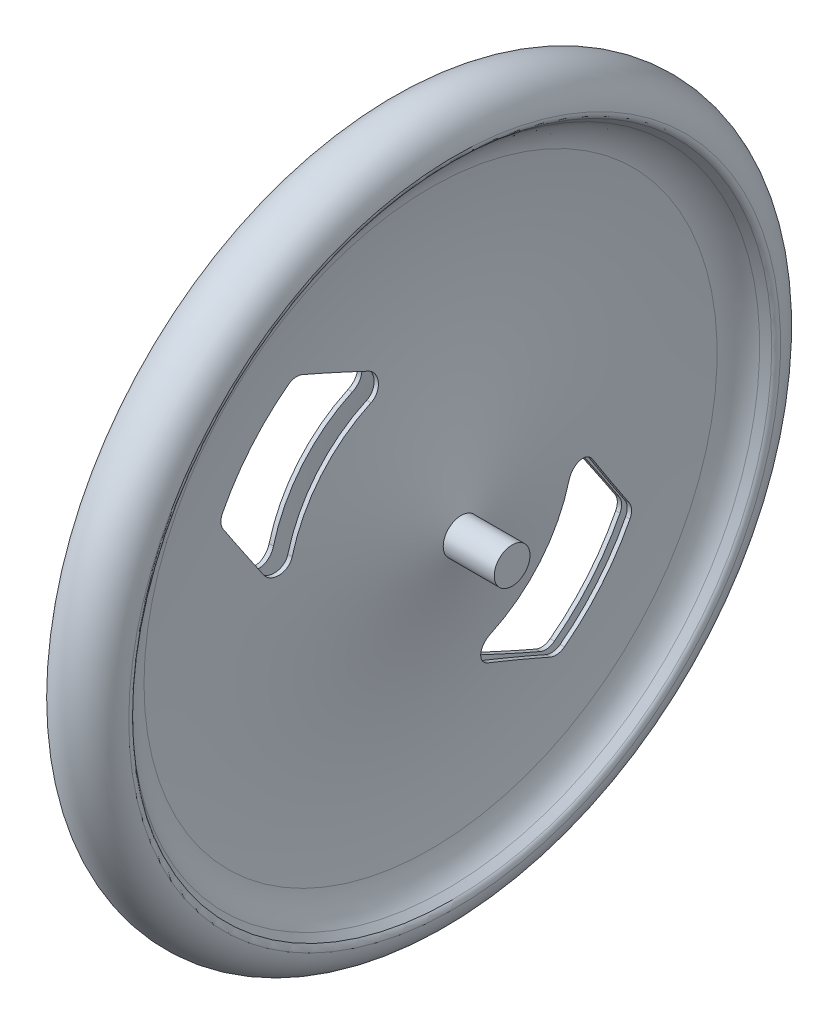
from build123d import *

# Parameters (mm, degrees)
SHELL2_T                                  = 3
CUT_EXTRUDE1_REACH                        = 356.77
CUT_EXTRUDE1_END_MAJOR_RADIUS             = 150.297892839
CUT_EXTRUDE1_END_MINOR_RADIUS             = 400
CUT_EXTRUDE1_DIRECTION_2_REACH            = 356.77
CUT_EXTRUDE1_DIRECTION_2_END_MAJOR_RADIUS = 150.297892839
CUT_EXTRUDE1_DIRECTION_2_END_MINOR_RADIUS = 400
SKETCH3_R                                 = 12.5
BOSS_EXTRUDE1_DEPTH                       = 65


with BuildPart() as part:
    # Sketch1 → Revolve1 (revolve)
    with BuildSketch(Plane.XY, mode=Mode.PRIVATE) as revolve1_sk:
        with BuildLine():
            Line((23.089545139, 223.396938031), (18.4881994, 219.535950518))
            ThreePointArc((18.4881994, 219.535950518), (11.430058579, 210.911190634), (8.007194137, 200.305162445))
            ThreePointArc((8.007194137, 200.305162445), (7.428056518, 105.123603262), (29.353674586, 12.5))
            Line((29.353674586, 12.5), (-29.353674586, 12.5))
            ThreePointArc((-29.353674586, 12.5), (-7.428056518, 105.123603262), (-8.007194137, 200.305162445))
            ThreePointArc((-8.007194137, 200.305162445), (-11.430058579, 210.911190634), (-18.4881994, 219.535950518))
            Line((-18.4881994, 219.535950518), (-23.089545139, 223.396938031))
            ThreePointArc((-23.089545139, 223.396938031), (-24.517932593, 225.37006199), (-24.844508864, 227.783950308))
            ThreePointArc((-24.844508864, 227.783950308), (0, 250), (24.844508864, 227.783950308))
            ThreePointArc((24.844508864, 227.783950308), (24.517932593, 225.37006199), (23.089545139, 223.396938031))
        make_face()
    revolve(revolve1_sk.sketch.rotate(Axis((0, 0, 0), (1, 0, 0)), 90), axis=Axis((0, 0, 0), (1, 0, 0)))

    # Shell2 (no face opened: a closed hollow body)
    add(offset(amount=-SHELL2_T, mode=Mode.PRIVATE), mode=Mode.SUBTRACT)

    # Cut-Extrude1: up to this torus (the profile starts outside it)
    cut_extrude1_end = Plane(origin=(-404.868974845, 0, 0), z_dir=(-1, 0, 0)) * Torus(CUT_EXTRUDE1_END_MAJOR_RADIUS, CUT_EXTRUDE1_END_MINOR_RADIUS, mode=Mode.PRIVATE)
    # Sketch2 → Cut-Extrude1 (cut, up to the surface)
    with BuildSketch(Plane(origin=(0, 0, 0), x_dir=(0, 0, -1), z_dir=(1, 0, 0)), mode=Mode.PRIVATE) as cut_extrude1_sk1:
        with BuildLine():
            Line((-114.771250416, 22.191352185), (-141.829895595, 62.842475678))
            ThreePointArc((-141.829895595, 62.842475678), (-143.489199527, 67.814248856), (-142.405776454, 72.942407641))
            ThreePointArc((-142.405776454, 72.942407641), (-122.567110899, 102.84601755), (-96.562752139, 127.575996564))
            ThreePointArc((-96.562752139, 127.575996564), (-91.700636051, 129.533455434), (-86.516260175, 128.762699409))
            Line((-86.516260175, 128.762699409), (-41.784034164, 109.174129365))
            ThreePointArc((-41.784034164, 109.174129365), (-35.79570037, 100.097142631), (-41.632140109, 90.921751578))
            ThreePointArc((-41.632140109, 90.921751578), (-76.604444312, 64.278760969), (-96.769791134, 25.211257882))
            ThreePointArc((-96.769791134, 25.211257882), (-104.792300255, 17.870196841), (-114.771250416, 22.191352185))
        make_face()
    cut_extrude1_tool1 = extrude(cut_extrude1_sk1.sketch, amount=-CUT_EXTRUDE1_REACH, mode=Mode.PRIVATE) - cut_extrude1_end
    add(cut_extrude1_tool1.solids().sort_by_distance((0, 80.180698, 95.555634))[0], mode=Mode.SUBTRACT)
    # Sketch2 → Cut-Extrude1 (cut, up to the surface)
    with BuildSketch(Plane(origin=(0, 0, 0), x_dir=(0, 0, -1), z_dir=(1, 0, 0)), mode=Mode.PRIVATE) as cut_extrude1_sk2:
        with BuildLine():
            Line((86.516260175, -128.762699409), (41.784034164, -109.174129365))
            ThreePointArc((41.784034164, -109.174129365), (35.79570037, -100.097142631), (41.632140109, -90.921751578))
            ThreePointArc((41.632140109, -90.921751578), (76.604444312, -64.278760969), (96.769791134, -25.211257882))
            ThreePointArc((96.769791134, -25.211257882), (104.792300255, -17.870196841), (114.771250416, -22.191352185))
            Line((114.771250416, -22.191352185), (141.829895595, -62.842475678))
            ThreePointArc((141.829895595, -62.842475678), (143.489199527, -67.814248856), (142.405776454, -72.942407641))
            ThreePointArc((142.405776454, -72.942407641), (122.567110899, -102.84601755), (96.562752139, -127.575996564))
            ThreePointArc((96.562752139, -127.575996564), (91.700636051, -129.533455434), (86.516260175, -128.762699409))
        make_face()
    cut_extrude1_tool2 = extrude(cut_extrude1_sk2.sketch, amount=-CUT_EXTRUDE1_REACH, mode=Mode.PRIVATE) - cut_extrude1_end
    add(cut_extrude1_tool2.solids().sort_by_distance((0, -80.180698, -95.555634))[0], mode=Mode.SUBTRACT)

    # Cut-Extrude1 direction 2: up to this torus (the profile starts outside it)
    cut_extrude1_direction_2_end = Plane(origin=(404.868974845, 0, 0), z_dir=(-1, 0, 0)) * Torus(CUT_EXTRUDE1_DIRECTION_2_END_MAJOR_RADIUS, CUT_EXTRUDE1_DIRECTION_2_END_MINOR_RADIUS, mode=Mode.PRIVATE)
    # Sketch2 → Cut-Extrude1 direction 2 (cut, up to the surface)
    with BuildSketch(Plane(origin=(0, 0, 0), x_dir=(0, 0, -1), z_dir=(1, 0, 0)), mode=Mode.PRIVATE) as cut_extrude1_direction_2_sk1:
        with BuildLine():
            Line((-114.771250416, 22.191352185), (-141.829895595, 62.842475678))
            ThreePointArc((-141.829895595, 62.842475678), (-143.489199527, 67.814248856), (-142.405776454, 72.942407641))
            ThreePointArc((-142.405776454, 72.942407641), (-122.567110899, 102.84601755), (-96.562752139, 127.575996564))
            ThreePointArc((-96.562752139, 127.575996564), (-91.700636051, 129.533455434), (-86.516260175, 128.762699409))
            Line((-86.516260175, 128.762699409), (-41.784034164, 109.174129365))
            ThreePointArc((-41.784034164, 109.174129365), (-35.79570037, 100.097142631), (-41.632140109, 90.921751578))
            ThreePointArc((-41.632140109, 90.921751578), (-76.604444312, 64.278760969), (-96.769791134, 25.211257882))
            ThreePointArc((-96.769791134, 25.211257882), (-104.792300255, 17.870196841), (-114.771250416, 22.191352185))
        make_face()
    cut_extrude1_direction_2_tool1 = extrude(cut_extrude1_direction_2_sk1.sketch, amount=CUT_EXTRUDE1_DIRECTION_2_REACH, mode=Mode.PRIVATE) - cut_extrude1_direction_2_end
    add(cut_extrude1_direction_2_tool1.solids().sort_by_distance((0, 80.180698, 95.555634))[0], mode=Mode.SUBTRACT)
    # Sketch2 → Cut-Extrude1 direction 2 (cut, up to the surface)
    with BuildSketch(Plane(origin=(0, 0, 0), x_dir=(0, 0, -1), z_dir=(1, 0, 0)), mode=Mode.PRIVATE) as cut_extrude1_direction_2_sk2:
        with BuildLine():
            Line((86.516260175, -128.762699409), (41.784034164, -109.174129365))
            ThreePointArc((41.784034164, -109.174129365), (35.79570037, -100.097142631), (41.632140109, -90.921751578))
            ThreePointArc((41.632140109, -90.921751578), (76.604444312, -64.278760969), (96.769791134, -25.211257882))
            ThreePointArc((96.769791134, -25.211257882), (104.792300255, -17.870196841), (114.771250416, -22.191352185))
            Line((114.771250416, -22.191352185), (141.829895595, -62.842475678))
            ThreePointArc((141.829895595, -62.842475678), (143.489199527, -67.814248856), (142.405776454, -72.942407641))
            ThreePointArc((142.405776454, -72.942407641), (122.567110899, -102.84601755), (96.562752139, -127.575996564))
            ThreePointArc((96.562752139, -127.575996564), (91.700636051, -129.533455434), (86.516260175, -128.762699409))
        make_face()
    cut_extrude1_direction_2_tool2 = extrude(cut_extrude1_direction_2_sk2.sketch, amount=CUT_EXTRUDE1_DIRECTION_2_REACH, mode=Mode.PRIVATE) - cut_extrude1_direction_2_end
    add(cut_extrude1_direction_2_tool2.solids().sort_by_distance((0, -80.180698, -95.555634))[0], mode=Mode.SUBTRACT)

    # Sketch3 → Boss-Extrude1 (add, symmetric)
    with BuildSketch(Plane(origin=(0, 0, 0), x_dir=(0, 0, -1), z_dir=(1, 0, 0))):
        with Locations(Location((0, 0, 0), (0, 0, 180))):
            Circle(SKETCH3_R)
    extrude(amount=BOSS_EXTRUDE1_DEPTH, both=True)


solid = part.part
